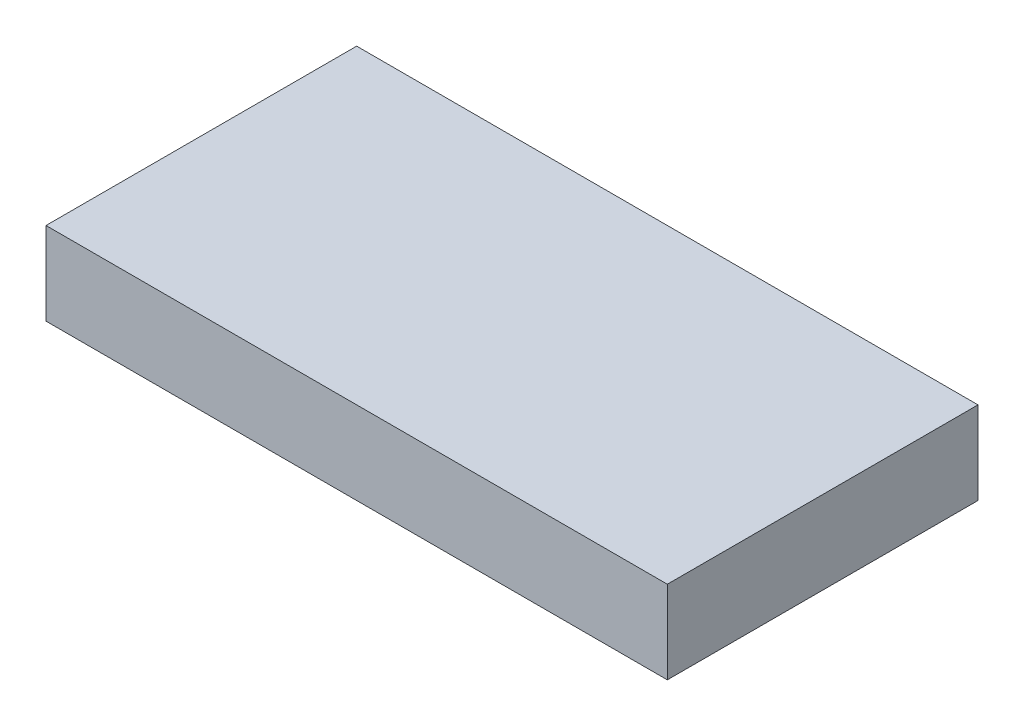
from build123d import *

# Parameters (mm, degrees)
ESBO_O1_W                = 60
ESBO_O1_H                = 30
RESSALTO_EXTRUS_O1_DEPTH = 8


with BuildPart() as part:
    # Esboço1 → Ressalto-extrusão1 (new body)
    with BuildSketch(Plane(origin=(0, 0, 0), x_dir=(1, 0, 0), z_dir=(0, 1, 0))):
        Rectangle(ESBO_O1_W, ESBO_O1_H)
    extrude(amount=RESSALTO_EXTRUS_O1_DEPTH)


solid = part.part
